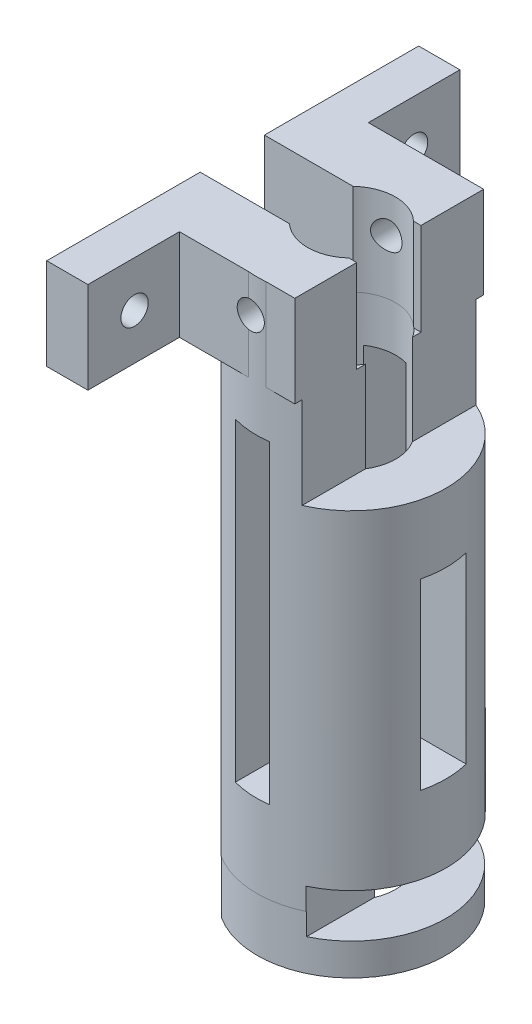
from build123d import *

# Parameters (mm, degrees)
SKETCH_1_R           = 20.68
SKETCH_1_R_2         = 9.68
EXTRUDE_1_DEPTH      = 116.68
SKETCH_11_W          = 27
SKETCH_11_H          = 150
CUT_EXTRUDE_3_DEPTH  = 40
SKETCH_13_W          = 10
SKETCH_13_H          = 128.345013401
CUT_EXTRUDE_7_DEPTH  = 126.614916312
SKETCH_15_W          = 8
SKETCH_15_H          = 68.68
CUT_EXTRUDE_9_DEPTH  = 48
SKETCH_16_W          = 15.549431524
SKETCH_16_H          = 20
SKETCH_16_W_2        = 15.459431524
EXTRUDE_4_DEPTH      = 19.2
SKETCH_17_W          = 19.20851187
SKETCH_17_H          = 14.03
CUT_EXTRUDE_10_DEPTH = 20.2
SKETCH_18_R          = 9.59
CUT_EXTRUDE_11_DEPTH = 121.289430957
SKETCH_21_R          = 2.985
CUT_EXTRUDE_12_DEPTH = 55.2
EXTRUDE_START        = 55.2
SKETCH_24_R          = 20.59
SKETCH_24_R_2        = 9.59
EXTRUDE_2_DEPTH      = 55.2
CUT_EXTRUDE_13_DEPTH = 55.2
SKETCH_26_W          = 10.00851187
SKETCH_26_H          = 41.68
CUT_EXTRUDE_15_DEPTH = 55.2
SKETCH_27_W          = 10
SKETCH_27_H          = 40
CUT_EXTRUDE_16_DEPTH = 55.2
SKETCH_28_W          = 44.880694938
SKETCH_28_H          = 9.608044066
CUT_EXTRUDE_17_DEPTH = 12.2
SKETCH_35_W          = 13.53
SKETCH_35_H          = 20
EXTRUDE_10_DEPTH     = 15
EXTRUDE_11_DEPTH     = 15
SKETCH_37_W          = 9
SKETCH_37_H          = 20
EXTRUDE_12_DEPTH     = 20
SKETCH_38_W          = 9
SKETCH_38_H          = 20
EXTRUDE_13_DEPTH     = 20
SKETCH_42_R          = 2.985
CUT_EXTRUDE_21_DEPTH = 20


with BuildPart() as part:
    # 草圖1 → 伸長-薄件1 (new body)
    with BuildSketch(Plane(origin=(0, 0, 0), x_dir=(1, 0, 0), z_dir=(0, 1, 0))):
        Circle(SKETCH_1_R)
        Circle(SKETCH_1_R_2, mode=Mode.SUBTRACT)
    extrude(amount=EXTRUDE_1_DEPTH)

    # 草圖11 → 除料-伸長3 (cut)
    with BuildSketch(Plane(origin=(0, 116.68, 0), x_dir=(1, 0, 0), z_dir=(0, 1, 0))):
        with Locations((21.70851187, -44.235815192)):
            Rectangle(SKETCH_11_W, SKETCH_11_H)
    extrude(amount=-CUT_EXTRUDE_3_DEPTH, mode=Mode.SUBTRACT)

    # 草圖13 → 除料-伸長7 (cut, through all)
    with BuildSketch(Plane.XY.offset(21)):
        with Locations((-16, 58.612182466)):
            Rectangle(SKETCH_13_W, SKETCH_13_H)
    extrude(amount=-CUT_EXTRUDE_7_DEPTH, mode=Mode.SUBTRACT)

    # 草圖15 → 除料-伸長9 (cut)
    with BuildSketch(Plane.XY.offset(21)):
        with Locations((-1.395744065, 52.34)):
            Rectangle(SKETCH_15_W, SKETCH_15_H)
    extrude(amount=-CUT_EXTRUDE_9_DEPTH, mode=Mode.SUBTRACT)

    # 草圖16 → 填料-伸長4 (add)
    with BuildSketch(Plane(origin=(8.20851187, 0, 0), x_dir=(0, 0, -1), z_dir=(1, 0, 0))):
        with Locations((12.905284238, 106.68)):
            Rectangle(SKETCH_16_W, SKETCH_16_H)
        with Locations((-12.860284238, 106.68)):
            Rectangle(SKETCH_16_W_2, SKETCH_16_H)
    extrude(amount=-EXTRUDE_4_DEPTH)

    # 草圖17 → 除料-伸長10 (cut)
    with BuildSketch(Plane(origin=(0, 116.68, 0), x_dir=(1, 0, 0), z_dir=(0, 1, 0))):
        with Locations((-1.395744065, -0.045)):
            Rectangle(SKETCH_17_W, SKETCH_17_H)
    extrude(amount=-CUT_EXTRUDE_10_DEPTH, mode=Mode.SUBTRACT)

    # 草圖18 → 除料-伸長11 (cut, through all)
    with BuildSketch(Plane.XZ):
        with Locations(Location((0, 0, 0), (0, 0, 90))):
            Circle(SKETCH_18_R)
    extrude(amount=-CUT_EXTRUDE_11_DEPTH, mode=Mode.SUBTRACT)

    # 草圖21 → 除料-伸長12 (cut)
    with BuildSketch(Plane(origin=(0, 0, -20.68), x_dir=(-1, 0, 0), z_dir=(0, 0, -1))):
        with Locations((1.39148813, 108.73)):
            Circle(SKETCH_21_R)
    extrude(amount=-CUT_EXTRUDE_12_DEPTH, mode=Mode.SUBTRACT)

    # 草圖24 → 伸長-薄件2 (add)
    with BuildSketch(Plane.XZ.offset(EXTRUDE_START)):
        Circle(SKETCH_24_R)
        Circle(SKETCH_24_R_2, mode=Mode.SUBTRACT)
    extrude(amount=-EXTRUDE_2_DEPTH)

    # 草圖25 → 除料-伸長13 (cut)
    with BuildSketch(Plane.XY.offset(21)):
        Polygon((-1.39148813, -11.785), (22.612379708, -11.785), (22.612379708, -63.873337429), (-22.749525245, -63.873337429), (-22.749525245, -11.785), align=None)
    extrude(amount=-CUT_EXTRUDE_13_DEPTH, mode=Mode.SUBTRACT)

    # 草圖26 → 除料-伸長15 (cut)
    with BuildSketch(Plane(origin=(0, 0, 0), x_dir=(1, 0, 0), z_dir=(0, 1, 0))):
        with Locations((-15.995744065, -0.16)):
            Rectangle(SKETCH_26_W, SKETCH_26_H)
    extrude(amount=-CUT_EXTRUDE_15_DEPTH, mode=Mode.SUBTRACT)

    # 草圖27 → 除料-伸長16 (cut)
    with BuildSketch(Plane(origin=(21, 0, 0), x_dir=(0, 0, -1), z_dir=(1, 0, 0))):
        with Locations((0, 41.68)):
            Rectangle(SKETCH_27_W, SKETCH_27_H)
    extrude(amount=-CUT_EXTRUDE_16_DEPTH, mode=Mode.SUBTRACT)

    # 草圖28 → 除料-伸長17 (cut)
    with BuildSketch(Plane(origin=(21, 0, 0), x_dir=(0, 0, -1), z_dir=(1, 0, 0))):
        Rectangle(SKETCH_28_W, SKETCH_28_H)
    extrude(amount=-CUT_EXTRUDE_17_DEPTH, mode=Mode.SUBTRACT)

    # 草圖35 → 填料-伸長10 (add)
    with BuildSketch(Plane.ZY.offset(10.99148813)):
        with Locations((13.825, 106.68)):
            Rectangle(SKETCH_35_W, SKETCH_35_H)
    extrude(amount=EXTRUDE_10_DEPTH)

    # 草圖36 → 填料-伸長11 (add)
    with BuildSketch(Plane.ZY.offset(10.99148813)):
        Polygon((-20.68, 116.68), (-6.97, 116.68), (-6.97, 96.48), (-20.68, 96.68), align=None)
    extrude(amount=EXTRUDE_11_DEPTH)

    # 草圖37 → 填料-伸長12 (add)
    with BuildSketch(Plane.XY.offset(20.59)):
        with Locations((-21.49148813, 106.68)):
            Rectangle(SKETCH_37_W, SKETCH_37_H)
    extrude(amount=EXTRUDE_12_DEPTH)

    # 草圖38 → 填料-伸長13 (add)
    with BuildSketch(Plane(origin=(0, 0, -20.68), x_dir=(-1, 0, 0), z_dir=(0, 0, -1))):
        with Locations((21.49148813, 106.68)):
            Rectangle(SKETCH_38_W, SKETCH_38_H)
    extrude(amount=EXTRUDE_13_DEPTH)

    # 草圖42 → 除料-伸長21 (cut)
    with BuildSketch(Plane(origin=(-16.99148813, 0, 0), x_dir=(0, 0, -1), z_dir=(1, 0, 0))):
        with Locations((30.68, 106.554418142)):
            Circle(SKETCH_42_R)
        with Locations((-30.395640125, 106.68)):
            Circle(SKETCH_42_R)
    extrude(amount=-CUT_EXTRUDE_21_DEPTH, mode=Mode.SUBTRACT)


solid = part.part
